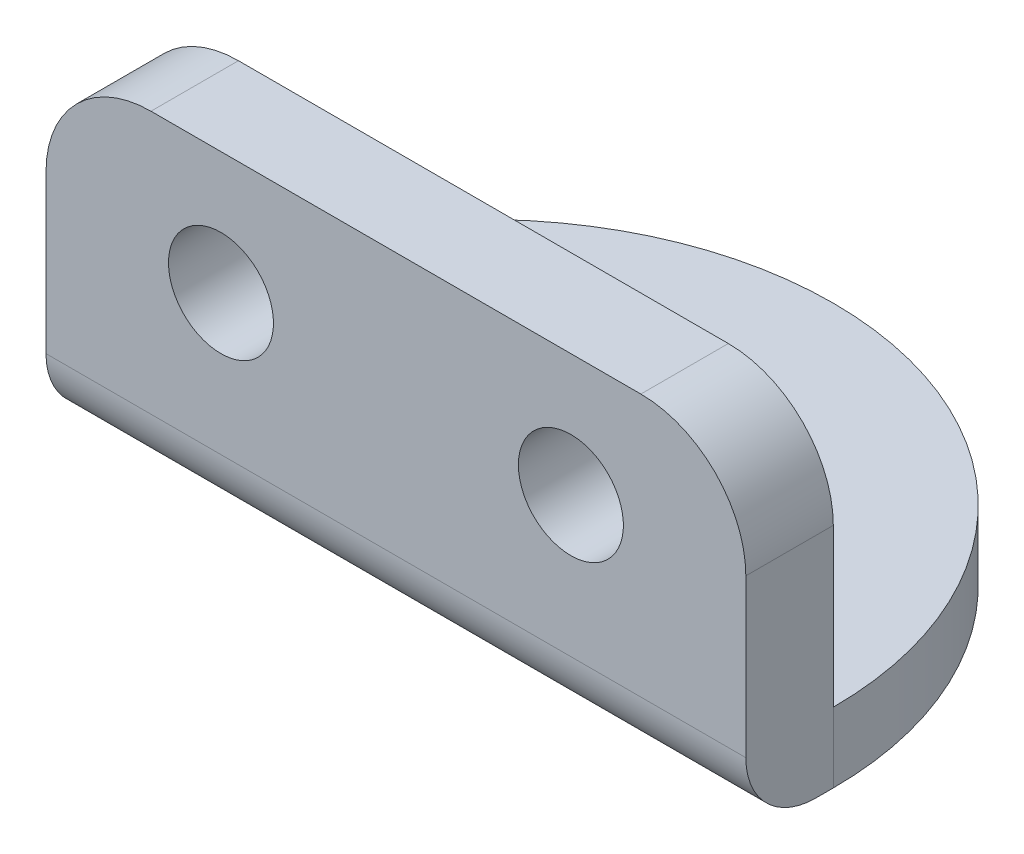
from build123d import *

# Parameters (mm, degrees)
SKETCH_1_R          = 1.5
EXTRUDE_2_DEPTH     = 2
SKETCH_1_5_W        = 20
SKETCH_1_5_H        = 2.5
EXTRUDE_3_DEPTH     = 9.5
SKETCH_2_R          = 1.5
CUT_EXTRUDE_1_DEPTH = 18.036725037
FILLET_1_R          = 3
FILLET_2_R          = 2


with BuildPart() as part:
    # 草图1 → 凸台-拉伸2 (new body)
    with BuildSketch(Plane(origin=(0, 0, 0), x_dir=(1, 0, 0), z_dir=(0, 1, 0))):
        with BuildLine():
            ThreePointArc((10, -3.23), (0, 6.77), (-10, -3.23))
            Line((-10, -3.23), (10, -3.23))
        make_face()
        Circle(SKETCH_1_R, mode=Mode.SUBTRACT)
    extrude(amount=EXTRUDE_2_DEPTH)

    # 草图1<5> → 凸台-拉伸3 (add)
    with BuildSketch(Plane(origin=(0, 0, 0), x_dir=(1, 0, 0), z_dir=(0, 1, 0))):
        with Locations((0, -4.48)):
            Rectangle(SKETCH_1_5_W, SKETCH_1_5_H)
    extrude(amount=EXTRUDE_3_DEPTH)

    # 草图2 → 切除-拉伸1 (cut, through all)
    with BuildSketch(Plane(origin=(0, 0, 3.23), x_dir=(-1, 0, 0), z_dir=(0, 0, -1))):
        with Locations((5, 6)):
            Circle(SKETCH_2_R)
        with Locations((-5, 6)):
            Circle(SKETCH_2_R)
    extrude(amount=-CUT_EXTRUDE_1_DEPTH, mode=Mode.SUBTRACT)

    # 圆角1
    fillet_1_edges = [part.edges().sort_by_distance(p)[0] for p in [
        (10, 9.5, 4.48),
        (-10, 9.5, 4.48),
    ]]
    fillet(fillet_1_edges, radius=FILLET_1_R)

    # 圆角2
    fillet_2_edges = [part.edges().sort_by_distance(p)[0] for p in [
        (0, 0, 5.73),
    ]]
    fillet(fillet_2_edges, radius=FILLET_2_R)


solid = part.part
